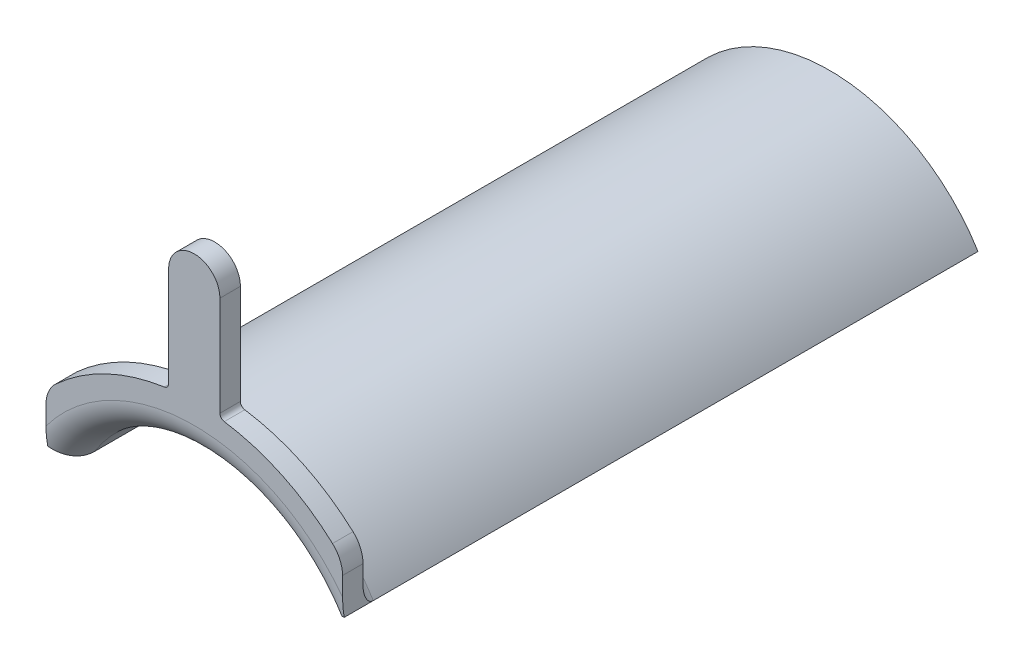
from build123d import *

# Parameters (mm, degrees)
EXTRUDE_6_DEPTH = 6
EXTRUDE_7_DEPTH = 0.2
EXTRUDE_START   = -0.2
EXTRUDE_8_DEPTH = 0.2
FILLET_4_R      = 0.05
FILLET_5_R      = 0.1
FILLET_6_R      = 0.3
FILLET_7_R      = 0.3


with BuildPart() as part:
    # Эскиз1 → Бобышка-Вытянуть6 (new body)
    with BuildSketch(Plane.XY):
        with BuildLine():
            Line((-1.273316217, 0.792884488), (-1.446606265, 0.892933544))
            ThreePointArc((-1.446606265, 0.892933544), (0, 1.7), (1.446606265, 0.892933544))
            Line((1.446606265, 0.892933544), (1.273316217, 0.792884488))
            ThreePointArc((1.273316217, 0.792884488), (0, 1.5), (-1.273316217, 0.792884488))
        make_face()
    extrude(amount=EXTRUDE_6_DEPTH)

    # Эскиз8 → Бобышка-Вытянуть7 (add)
    with BuildSketch(Plane.XY.offset(6)):
        with BuildLine():
            Line((-1.273316217, 0.792884488), (-1.446606265, 0.892933544))
            Line((-1.446606265, 0.892933544), (-1.446606265, 1.3810613))
            ThreePointArc((-1.446606265, 1.3810613), (0, 2), (1.446606265, 1.3810613))
            Line((1.446606265, 1.3810613), (1.446606265, 0.892933544))
            Line((1.446606265, 0.892933544), (1.273316217, 0.792884488))
            ThreePointArc((1.273316217, 0.792884488), (0, 1.5), (-1.273316217, 0.792884488))
        make_face()
    extrude(amount=EXTRUDE_7_DEPTH)

    # Эскиз9 → Бобышка-Вытянуть8 (add)
    with BuildSketch(Plane.XY.offset(6.2).offset(EXTRUDE_START)):
        with BuildLine():
            Line((-0.25, 1.984313483), (-0.25, 3))
            ThreePointArc((-0.25, 3), (0, 3.25), (0.25, 3))
            Line((0.25, 3), (0.25, 1.984313483))
            ThreePointArc((0.25, 1.984313483), (0, 2), (-0.25, 1.984313483))
        make_face()
    extrude(amount=EXTRUDE_8_DEPTH)

    # Скругление4
    fillet_4_edges = [part.edges().sort_by_distance(p)[0] for p in [
        (0.25, 1.984313483, 6.1),
        (-0.25, 1.984313483, 6.1),
    ]]
    fillet(fillet_4_edges, radius=FILLET_4_R)

    # Скругление5
    fillet_5_edges = [part.edges().sort_by_distance(p)[0] for p in [
        (0, 1.7, 6),
    ]]
    fillet(fillet_5_edges, radius=FILLET_5_R)

    # Скругление6
    fillet_6_edges = [part.edges().sort_by_distance(p)[0] for p in [
        (0, 1.5, 6.2),
    ]]
    fillet(fillet_6_edges, radius=FILLET_6_R)

    # Скругление7
    fillet_7_edges = [part.edges().sort_by_distance(p)[0] for p in [
        (1.446606265, 1.3810613, 6.1),
        (-1.446606265, 1.3810613, 6.1),
    ]]
    fillet(fillet_7_edges, radius=FILLET_7_R)


solid = part.part
